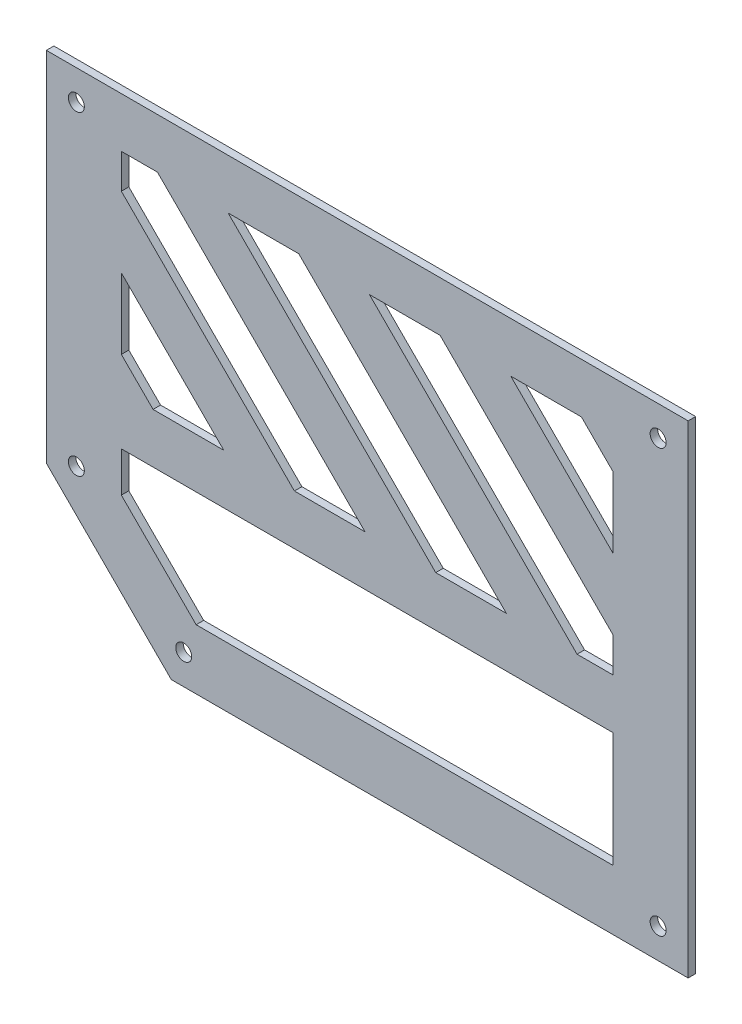
from build123d import *

# Parameters (mm, degrees)
BOSS_EXTRUDE1_DEPTH = 1.5
SKETCH2_R           = 1.6
CUT_EXTRUDE1_DEPTH  = 3.5
CUT_EXTRUDE3_DEPTH  = 10


with BuildPart() as part:
    # Sketch1 → Boss-Extrude1 (new body)
    with BuildSketch(Plane.XY):
        Polygon((-117.914742868, 608.080871166), (-117.914742868, 536.530029297), (-92.914742868, 511.530029297), (10.5, 511.530029297), (10.5, 608.080871166), align=None)
        Polygon((-4.5, 523.530029297), (-4.5, 546.530029297), (-102.914742868, 546.530029297), (-102.914742868, 538.500592045), (-87.94418012, 523.530029297), align=None, mode=Mode.SUBTRACT)
    extrude(amount=BOSS_EXTRUDE1_DEPTH)

    # Sketch2 → Cut-Extrude1 (cut)
    with BuildSketch(Plane.XY.offset(1.5)):
        with Locations((-111.914742868, 539.015310671)):
            Circle(SKETCH2_R)
        with Locations((-90.429461494, 517.530029297)):
            Circle(SKETCH2_R)
        with Locations((-111.914742868, 602.080871166)):
            Circle(SKETCH2_R)
        with Locations((4.5, 602.080871166)):
            Circle(SKETCH2_R)
        with Locations((4.5, 517.530029297)):
            Circle(SKETCH2_R)
    extrude(amount=-CUT_EXTRUDE1_DEPTH, mode=Mode.SUBTRACT)

    # Sketch3 → Cut-Extrude3 (cut)
    with BuildSketch(Plane.XY.offset(1.5)):
        Polygon((-82.4219505, 556.530029297), (-102.914742868, 577.022821666), (-102.914742868, 562.882821666), (-96.5619505, 556.530029297), align=None)
        Polygon((-95.692792369, 598.080871166), (-102.914742868, 598.080871166), (-102.914742868, 591.162821666), (-68.2819505, 556.530029297), (-54.1419505, 556.530029297), align=None)
        Polygon((-67.412792369, 598.080871166), (-81.552792369, 598.080871166), (-40.0019505, 556.530029297), (-25.8619505, 556.530029297), align=None)
        Polygon((-39.132792369, 598.080871166), (-53.272792369, 598.080871166), (-11.7219505, 556.530029297), (-4.5, 556.530029297), (-4.5, 563.448078797), align=None)
        Polygon((-10.852792369, 598.080871166), (-24.992792369, 598.080871166), (-4.5, 577.588078797), (-4.5, 591.728078797), align=None)
    extrude(amount=-CUT_EXTRUDE3_DEPTH, mode=Mode.SUBTRACT)


solid = part.part
